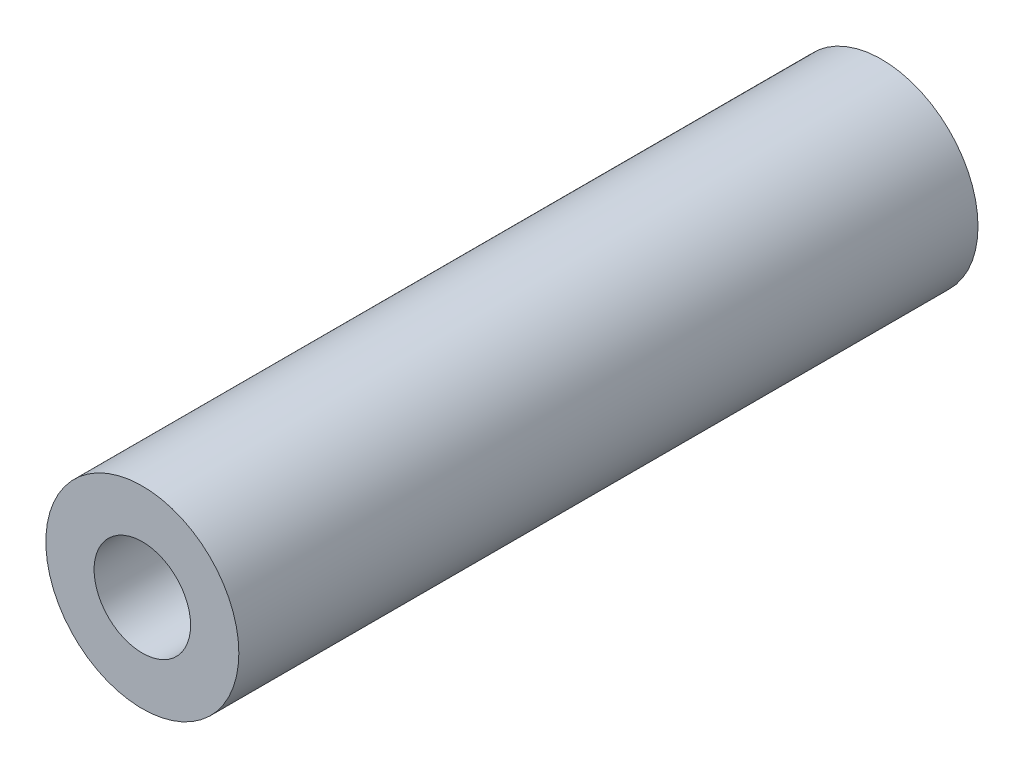
from build123d import *

# Parameters (mm, degrees)
SKETCH1_R                 = 2.5
BOSS_EXTRUDE1_DEPTH       = 9.575
M3X0_5_TAPPED_HOLE1_D     = 2.5
M3X0_5_TAPPED_HOLE1_DEPTH = 9.575


with BuildPart() as part:
    # Sketch1 → Boss-Extrude1 (new, symmetric)
    with BuildSketch(Plane.XY):
        Circle(SKETCH1_R)
    extrude(amount=BOSS_EXTRUDE1_DEPTH, both=True)

    # M3x0.5 Tapped Hole1
    with Locations(Plane.XY.offset(9.575)):
        with Locations((0, 0)):
            m3x0_5_tapped_hole1 = Hole(M3X0_5_TAPPED_HOLE1_D / 2, depth=M3X0_5_TAPPED_HOLE1_DEPTH)

    # Mirror1: M3x0.5 Tapped Hole1 across plane
    add(m3x0_5_tapped_hole1.mirror(Plane.XY), mode=Mode.SUBTRACT)


solid = part.part
